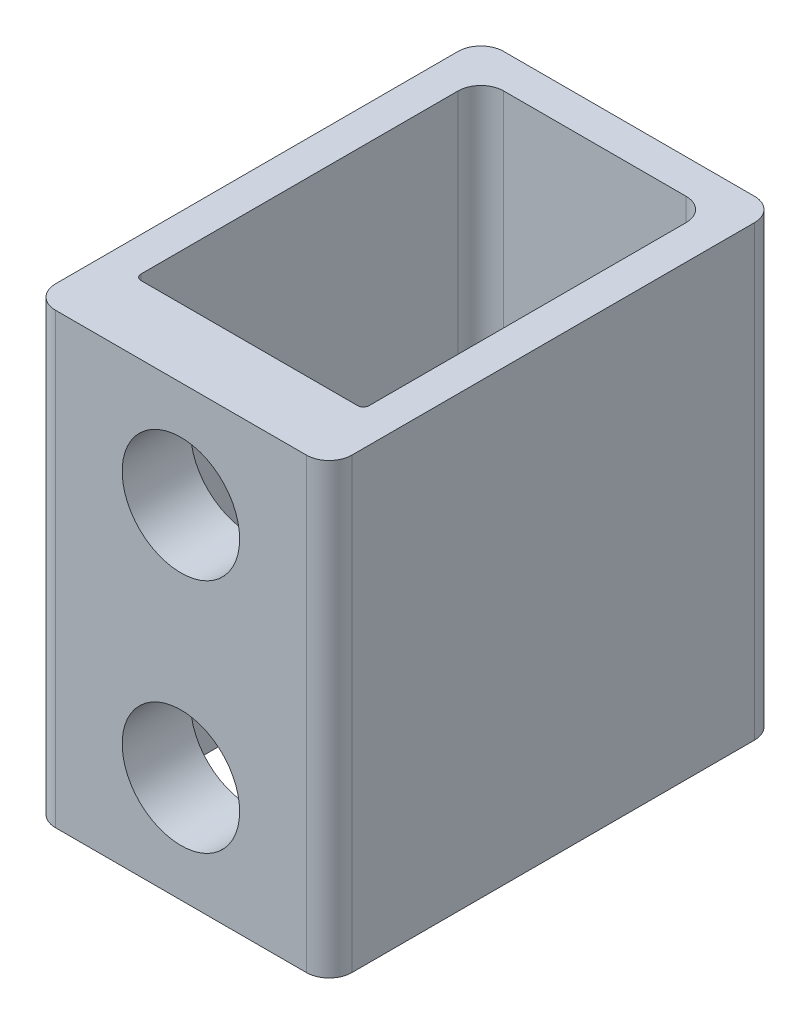
from build123d import *

# Parameters (mm, degrees)
SALIENTE_EXTRUIR1_DEPTH = 19.65
CROQUIS2_R              = 2.575
CORTAR_EXTRUIR1_DEPTH   = 8.65


with BuildPart() as part:
    # Croquis1 → Saliente-Extruir1 (new body)
    with BuildSketch(Plane(origin=(0, 0, 0), x_dir=(1, 0, 0), z_dir=(0, 1, 0))):
        with BuildLine():
            Line((-5.5, 9.825), (5.5, 9.825))
            ThreePointArc((5.5, 9.825), (6.207106781, 9.532106781), (6.5, 8.825))
            Line((6.5, 8.825), (6.5, -8.825))
            ThreePointArc((6.5, -8.825), (6.207106781, -9.532106781), (5.5, -9.825))
            Line((5.5, -9.825), (-5.5, -9.825))
            ThreePointArc((-5.5, -9.825), (-6.207106781, -9.532106781), (-6.5, -8.825))
            Line((-6.5, -8.825), (-6.5, 8.825))
            ThreePointArc((-6.5, 8.825), (-6.207106781, 9.532106781), (-5.5, 9.825))
        make_face()
        with BuildLine():
            Line((-4.75, -6.825), (4.75, -6.825))
            ThreePointArc((4.75, -6.825), (4.926776695, -6.751776695), (5, -6.575))
            Line((5, -6.575), (5, 7.325))
            ThreePointArc((5, 7.325), (4.707106781, 8.032106781), (4, 8.325))
            Line((4, 8.325), (-4, 8.325))
            ThreePointArc((-4, 8.325), (-4.707106781, 8.032106781), (-5, 7.325))
            Line((-5, 7.325), (-5, -6.575))
            ThreePointArc((-5, -6.575), (-4.926776695, -6.751776695), (-4.75, -6.825))
        make_face(mode=Mode.SUBTRACT)
    extrude(amount=-SALIENTE_EXTRUIR1_DEPTH)

    # Croquis2 → Cortar-Extruir1 (cut)
    with BuildSketch(Plane.XY.offset(9.825)):
        with Locations((0, -4.65)):
            Circle(CROQUIS2_R)
        with Locations((0, -15)):
            Circle(CROQUIS2_R)
    extrude(amount=-CORTAR_EXTRUIR1_DEPTH, mode=Mode.SUBTRACT)


solid = part.part
